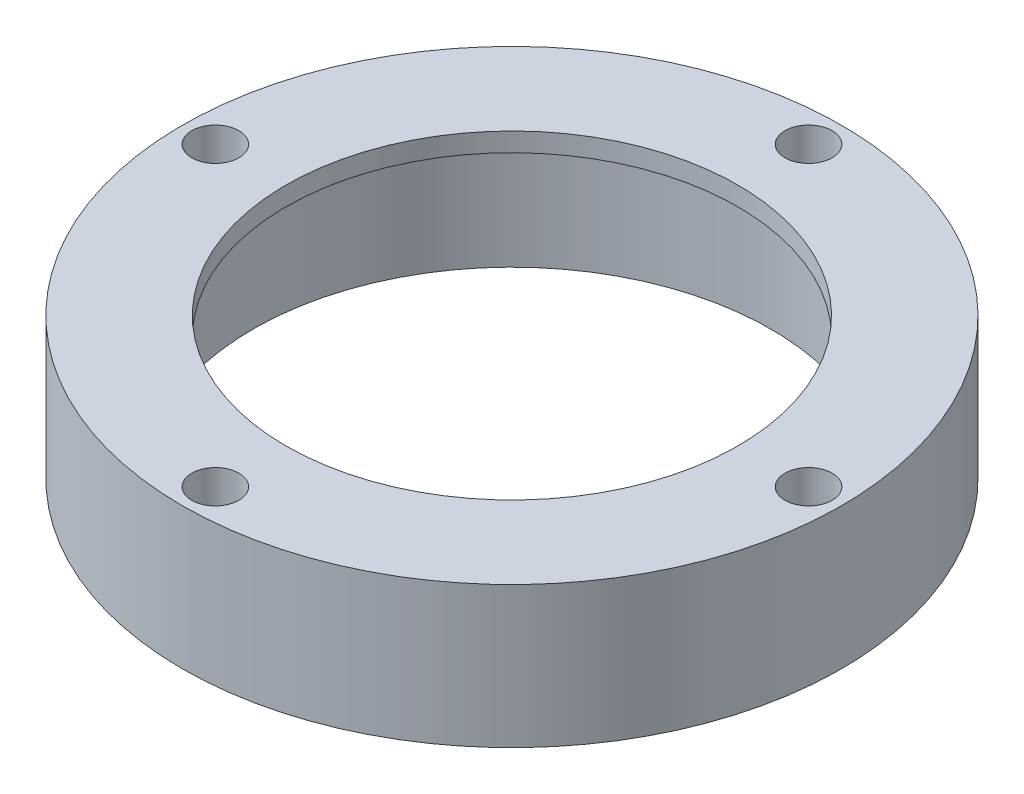
from build123d import *

# Parameters (mm, degrees)
SKETCH_2_R          = 2.5
CUT_EXTRUDE_1_DEPTH = 22


with BuildPart() as part:
    # Эскиз1 → Повернуть1 (revolve)
    with BuildSketch(Plane.XY, mode=Mode.PRIVATE) as revolve_1_sk:
        Polygon((24, 14.784875022), (35, 14.784875022), (35, -0.215124978), (27.5, -0.215124978), (27.5, 12.784875022), (24, 12.784875022), align=None)
    revolve(revolve_1_sk.sketch.rotate(Axis((0, 60.609800664, 0), (0, -1, 0)), 90), axis=Axis((0, 60.609800664, 0), (0, -1, 0)))

    # Эскиз2 → Вырез-Вытянуть1 (cut)
    with BuildSketch(Plane.XZ.offset(0.215124978)):
        with Locations(Location((0, 31.5, 0), (0, 0, 270))):
            Circle(SKETCH_2_R)
        with Locations(Location((0, -31.5, 0), (0, 0, 270))):
            Circle(SKETCH_2_R)
        with Locations(Location((31.5, 0, 0), (0, 0, 270))):
            Circle(SKETCH_2_R)
        with Locations(Location((-31.5, 0, 0), (0, 0, 270))):
            Circle(SKETCH_2_R)
    extrude(amount=-CUT_EXTRUDE_1_DEPTH, mode=Mode.SUBTRACT)


solid = part.part
